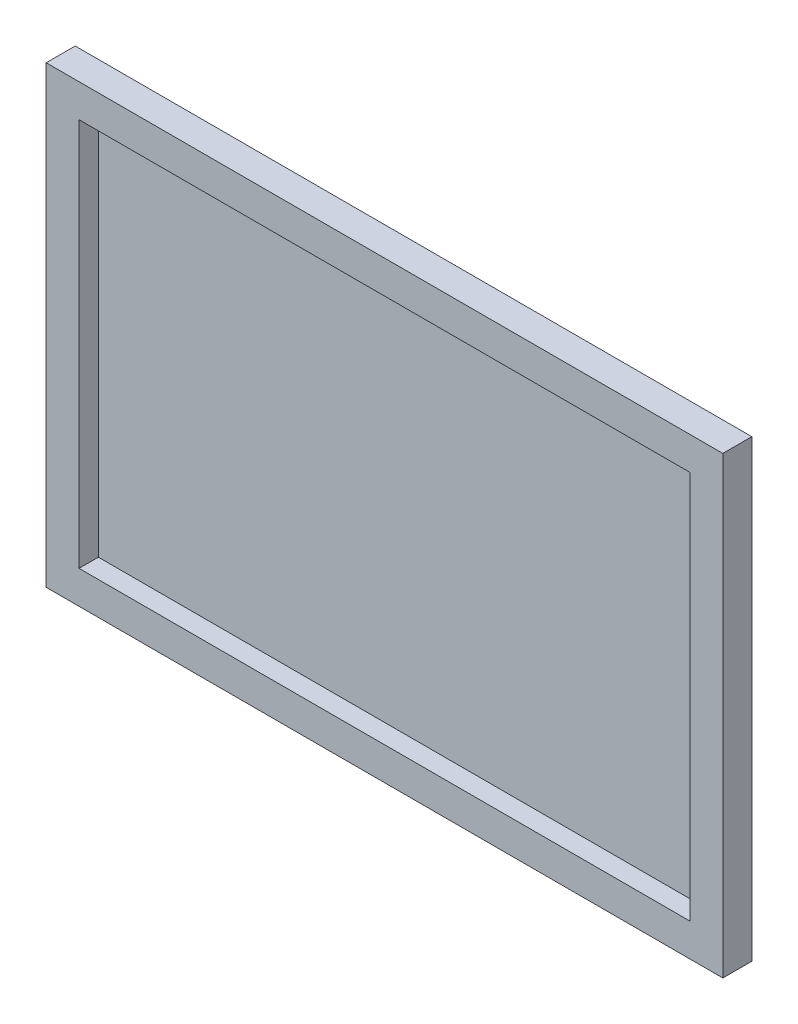
from build123d import *

# Parameters (mm, degrees)
SKETCH_1_W          = 350
SKETCH_1_H          = 235
EXTRUDE_1_DEPTH     = 15
SKETCH_2_W          = 316
SKETCH_2_H          = 201
CUT_EXTRUDE_1_DEPTH = 10


with BuildPart() as part:
    # 草图1 → 凸台-拉伸1 (new body)
    with BuildSketch(Plane.XY):
        Rectangle(SKETCH_1_W, SKETCH_1_H)
    extrude(amount=EXTRUDE_1_DEPTH)

    # 草图2 → 切除-拉伸1 (cut)
    with BuildSketch(Plane.XY.offset(15)):
        Rectangle(SKETCH_2_W, SKETCH_2_H)
    extrude(amount=-CUT_EXTRUDE_1_DEPTH, mode=Mode.SUBTRACT)


solid = part.part
